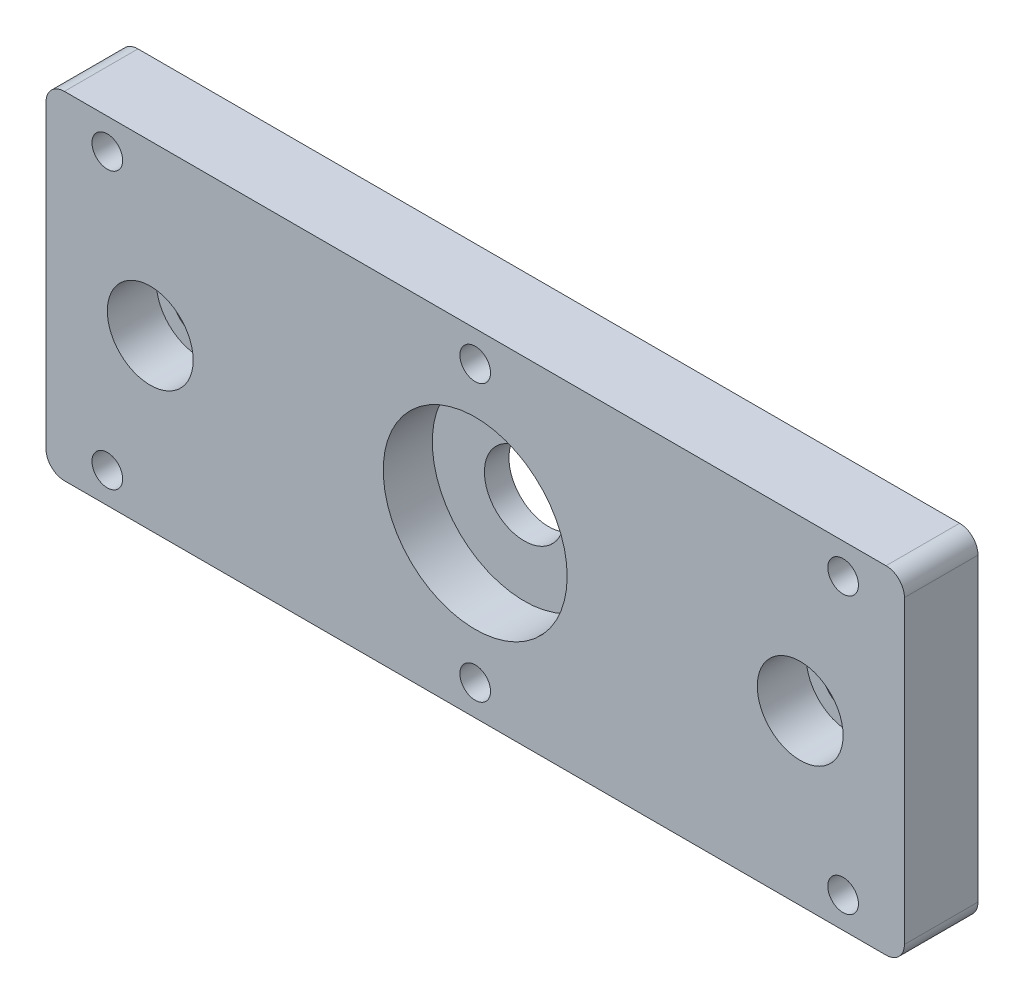
from build123d import *

# Parameters (mm, degrees)
SKETCH_1_W          = 140
SKETCH_1_H          = 55
EXTRUDE_1_DEPTH     = 12
SKETCH_2_R          = 6.5
SKETCH_2_R_2        = 4.5
CUT_EXTRUDE_1_DEPTH = 77.159372371
FILLET_1_R          = 3
SKETCH_10_R         = 7
CUT_EXTRUDE_2_DEPTH = 8
SKETCH_11_R         = 15
CUT_EXTRUDE_3_DEPTH = 8
HOLE_WIZARD_M6_1_D  = 5


with BuildPart() as part:
    # 草图1 → 凸台-拉伸1 (new body)
    with BuildSketch(Plane.XY):
        Rectangle(SKETCH_1_W, SKETCH_1_H)
    extrude(amount=EXTRUDE_1_DEPTH)

    # 草图2 → 切除-拉伸1 (cut, through all)
    with BuildSketch(Plane.XY.offset(12)):
        Circle(SKETCH_2_R)
        with Locations((-53, 0)):
            Circle(SKETCH_2_R_2)
        with Locations((53, 0)):
            Circle(SKETCH_2_R_2)
    extrude(amount=-CUT_EXTRUDE_1_DEPTH, mode=Mode.SUBTRACT)

    # 圆角1
    fillet_1_edges = [part.edges().sort_by_distance(p)[0] for p in [
        (70, -27.5, 6),
        (-70, -27.5, 6),
        (-70, 27.5, 6),
        (70, 27.5, 6),
    ]]
    fillet(fillet_1_edges, radius=FILLET_1_R)

    # 草图10 → 切除-拉伸2 (cut)
    with BuildSketch(Plane.XY.offset(12)):
        with Locations((-53, 0)):
            Circle(SKETCH_10_R)
        with Locations((53, 0)):
            Circle(SKETCH_10_R)
    extrude(amount=-CUT_EXTRUDE_2_DEPTH, mode=Mode.SUBTRACT)

    # 草图11 → 切除-拉伸3 (cut)
    with BuildSketch(Plane.XY.offset(12)):
        Circle(SKETCH_11_R)
    extrude(amount=-CUT_EXTRUDE_3_DEPTH, mode=Mode.SUBTRACT)

    # M6 螺纹孔1 (through all)
    with Locations(Plane.XY.offset(12)):
        with Locations((-60, 22.5), (-60, -22.5), (0, -22.5), (0, 22.5), (60, 22.5), (60, -22.5)):
            Hole(HOLE_WIZARD_M6_1_D / 2)


solid = part.part
